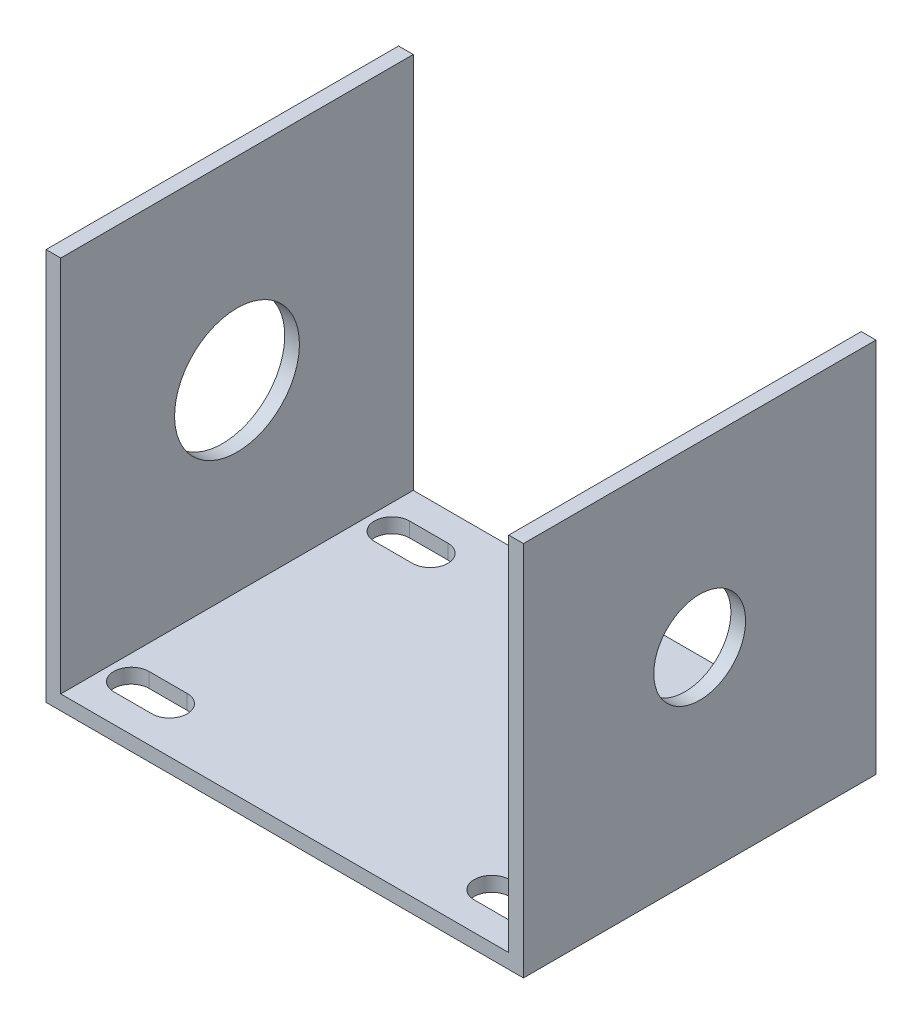
from build123d import *

# Parameters (mm, degrees)
SKETCH1_W               = 1
SKETCH1_H               = 25.7
SKETCH1_H_2             = 1
SKETCH1_W_2             = 30.5
SKETCH1_H_3             = 24.613793103
BOSS_EXTRUDE1_DEPTH     = 12
CUT_EXTRUDE1_DEPTH      = 44.43604494
CUT_EXTRUDE1_DEPTH_BACK = 44.43604494
SKETCH2_R               = 3.125
CUT_EXTRUDE2_DEPTH      = 44.43604494
CUT_EXTRUDE2_DEPTH_BACK = 24
SKETCH3_R               = 4.25
CUT_EXTRUDE3_DEPTH      = 24


with BuildPart() as part:
    # Sketch1 → Boss-Extrude1 (new, symmetric)
    with BuildSketch(Plane.XY):
        with Locations((-15.75, 13.35)):
            Rectangle(SKETCH1_W, SKETCH1_H)
        with Locations((-15.75, 0)):
            Rectangle(SKETCH1_W, SKETCH1_H_2)
        Rectangle(SKETCH1_W_2, SKETCH1_H_2)
        with Locations((15.75, 0)):
            Rectangle(SKETCH1_W, SKETCH1_H_2)
        with Locations((15.75, 12.806896552)):
            Rectangle(SKETCH1_W, SKETCH1_H_3)
    extrude(amount=BOSS_EXTRUDE1_DEPTH, both=True)

    # Sketch2 → Cut-Extrude1 (cut, two sides: drawn at the far end of the back side and taken through both)
    with BuildSketch(Plane(origin=(16.25, 0, 0), x_dir=(0, 0, -1), z_dir=(1, 0, 0)).offset(-CUT_EXTRUDE1_DEPTH_BACK)):
        with Locations((0, 13)):
            Circle(SKETCH2_R)
    extrude(amount=CUT_EXTRUDE1_DEPTH + CUT_EXTRUDE1_DEPTH_BACK, mode=Mode.SUBTRACT)

    # Sketch3 → Cut-Extrude2 (cut, two sides: drawn at the far end of the back side and taken through both)
    with BuildSketch(Plane.ZY.offset(16.25).offset(-CUT_EXTRUDE2_DEPTH_BACK)):
        with Locations(Location((0, 13, 0), (0, 0, 90))):
            Circle(SKETCH3_R)
    extrude(amount=CUT_EXTRUDE2_DEPTH + CUT_EXTRUDE2_DEPTH_BACK, mode=Mode.SUBTRACT)

    # Sketch4 → Cut-Extrude3 (cut)
    with BuildSketch(Plane.XZ.offset(0.5)):
        with BuildLine():
            ThreePointArc((-13.57, -7.67), (-14.77, -8.87), (-13.57, -10.07))
            Line((-13.57, -10.07), (-13.57, -7.67))
        make_face()
        with BuildLine():
            Line((-13.57, -7.67), (-13.57, -10.07))
            ThreePointArc((-13.57, -10.07), (-12.721471863, -9.718528137), (-12.37, -8.87))
            ThreePointArc((-12.37, -8.87), (-12.721471863, -8.021471863), (-13.57, -7.67))
        make_face()
        with BuildLine():
            Line((-13.57, -10.07), (-10.97, -10.07))
            ThreePointArc((-10.97, -10.07), (-12.17, -8.87), (-10.97, -7.67))
            Line((-10.97, -7.67), (-13.57, -7.67))
            ThreePointArc((-13.57, -7.67), (-12.721471863, -8.021471863), (-12.37, -8.87))
            ThreePointArc((-12.37, -8.87), (-12.721471863, -9.718528137), (-13.57, -10.07))
        make_face()
        with BuildLine():
            ThreePointArc((-10.97, -7.67), (-12.17, -8.87), (-10.97, -10.07))
            Line((-10.97, -10.07), (-10.97, -7.67))
        make_face()
        with BuildLine():
            Line((-10.97, -7.67), (-10.97, -10.07))
            ThreePointArc((-10.97, -10.07), (-10.121471863, -9.718528137), (-9.77, -8.87))
            ThreePointArc((-9.77, -8.87), (-10.121471863, -8.021471863), (-10.97, -7.67))
        make_face()
        with BuildLine():
            ThreePointArc((10.97, -7.67), (9.77, -8.87), (10.97, -10.07))
            Line((10.97, -10.07), (10.97, -7.67))
        make_face()
        with BuildLine():
            Line((10.97, -7.67), (10.97, -10.07))
            ThreePointArc((10.97, -10.07), (11.818528137, -9.718528137), (12.17, -8.87))
            ThreePointArc((12.17, -8.87), (11.818528137, -8.021471863), (10.97, -7.67))
        make_face()
        with BuildLine():
            Line((10.97, -10.07), (13.57, -10.07))
            ThreePointArc((13.57, -10.07), (12.37, -8.87), (13.57, -7.67))
            Line((13.57, -7.67), (10.97, -7.67))
            ThreePointArc((10.97, -7.67), (11.818528137, -8.021471863), (12.17, -8.87))
            ThreePointArc((12.17, -8.87), (11.818528137, -9.718528137), (10.97, -10.07))
        make_face()
        with BuildLine():
            ThreePointArc((13.57, -7.67), (12.37, -8.87), (13.57, -10.07))
            Line((13.57, -10.07), (13.57, -7.67))
        make_face()
        with BuildLine():
            Line((13.57, -7.67), (13.57, -10.07))
            ThreePointArc((13.57, -10.07), (14.418528137, -9.718528137), (14.77, -8.87))
            ThreePointArc((14.77, -8.87), (14.418528137, -8.021471863), (13.57, -7.67))
        make_face()
        with BuildLine():
            ThreePointArc((12.17, 8.87), (11.818528137, 9.718528137), (10.97, 10.07))
            Line((10.97, 10.07), (10.97, 7.67))
            ThreePointArc((10.97, 7.67), (11.818528137, 8.021471863), (12.17, 8.87))
        make_face()
        with BuildLine():
            Line((10.97, 7.67), (10.97, 10.07))
            ThreePointArc((10.97, 10.07), (9.77, 8.87), (10.97, 7.67))
        make_face()
        with BuildLine():
            Line((13.57, 10.07), (10.97, 10.07))
            ThreePointArc((10.97, 10.07), (11.818528137, 9.718528137), (12.17, 8.87))
            ThreePointArc((12.17, 8.87), (11.818528137, 8.021471863), (10.97, 7.67))
            Line((10.97, 7.67), (13.57, 7.67))
            ThreePointArc((13.57, 7.67), (12.37, 8.87), (13.57, 10.07))
        make_face()
        with BuildLine():
            ThreePointArc((14.77, 8.87), (14.418528137, 9.718528137), (13.57, 10.07))
            Line((13.57, 10.07), (13.57, 7.67))
            ThreePointArc((13.57, 7.67), (14.418528137, 8.021471863), (14.77, 8.87))
        make_face()
        with BuildLine():
            Line((13.57, 7.67), (13.57, 10.07))
            ThreePointArc((13.57, 10.07), (12.37, 8.87), (13.57, 7.67))
        make_face()
        with BuildLine():
            ThreePointArc((-12.37, 8.87), (-12.721471863, 9.718528137), (-13.57, 10.07))
            Line((-13.57, 10.07), (-13.57, 7.67))
            ThreePointArc((-13.57, 7.67), (-12.721471863, 8.021471863), (-12.37, 8.87))
        make_face()
        with BuildLine():
            Line((-13.57, 7.67), (-13.57, 10.07))
            ThreePointArc((-13.57, 10.07), (-14.77, 8.87), (-13.57, 7.67))
        make_face()
        with BuildLine():
            Line((-10.97, 10.07), (-13.57, 10.07))
            ThreePointArc((-13.57, 10.07), (-12.721471863, 9.718528137), (-12.37, 8.87))
            ThreePointArc((-12.37, 8.87), (-12.721471863, 8.021471863), (-13.57, 7.67))
            Line((-13.57, 7.67), (-10.97, 7.67))
            ThreePointArc((-10.97, 7.67), (-12.17, 8.87), (-10.97, 10.07))
        make_face()
        with BuildLine():
            ThreePointArc((-9.77, 8.87), (-10.121471863, 9.718528137), (-10.97, 10.07))
            Line((-10.97, 10.07), (-10.97, 7.67))
            ThreePointArc((-10.97, 7.67), (-10.121471863, 8.021471863), (-9.77, 8.87))
        make_face()
        with BuildLine():
            Line((-10.97, 7.67), (-10.97, 10.07))
            ThreePointArc((-10.97, 10.07), (-12.17, 8.87), (-10.97, 7.67))
        make_face()
    extrude(amount=-CUT_EXTRUDE3_DEPTH, mode=Mode.SUBTRACT)


solid = part.part
